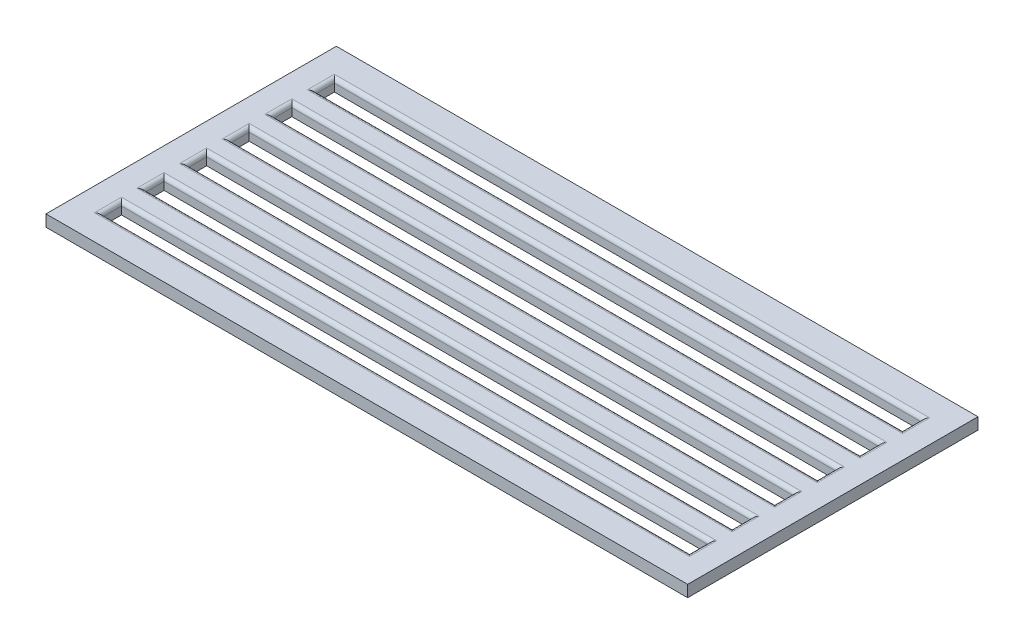
from build123d import *

# Parameters (mm, degrees)
SKETCH1_W           = 165.75
SKETCH1_H           = 75
BOSS_EXTRUDE1_DEPTH = 3
SKETCH2_W           = 151.75
SKETCH2_H           = 5
CUT_EXTRUDE1_DEPTH  = 183.692731916
FILLET4_R           = 1
FILLET5_R           = 1
FILLET6_R           = 1
FILLET7_R           = 1
FILLET8_R           = 1
FILLET9_R           = 1
FILLET10_R          = 1
FILLET11_R          = 1
FILLET12_R          = 1
FILLET13_R          = 1
FILLET14_R          = 1
FILLET15_R          = 1
FILLET16_R          = 1
FILLET17_R          = 1
FILLET18_R          = 1
FILLET19_R          = 1
FILLET20_R          = 1
FILLET21_R          = 1
FILLET22_R          = 1
FILLET23_R          = 1
FILLET24_R          = 1
FILLET25_R          = 1
FILLET26_R          = 1
FILLET27_R          = 1


with BuildPart() as part:
    # Sketch1 → Boss-Extrude1 (new body)
    with BuildSketch(Plane(origin=(0, 0, 0), x_dir=(1, 0, 0), z_dir=(0, 1, 0))):
        with Locations((-81.877808989, 41.393258427)):
            Rectangle(SKETCH1_W, SKETCH1_H)
    extrude(amount=BOSS_EXTRUDE1_DEPTH)

    # Sketch2 → Cut-Extrude1 (cut, through all)
    with BuildSketch(Plane(origin=(0, 3, 0), x_dir=(1, 0, 0), z_dir=(0, 1, 0))):
        with Locations((-81.877808989, 68.893258427)):
            Rectangle(SKETCH2_W, SKETCH2_H)
        with Locations((-81.877808989, 57.893258427)):
            Rectangle(SKETCH2_W, SKETCH2_H)
        with Locations((-81.877808989, 46.893258427)):
            Rectangle(SKETCH2_W, SKETCH2_H)
        with Locations((-81.877808989, 35.893258427)):
            Rectangle(SKETCH2_W, SKETCH2_H)
        with Locations((-81.877808989, 24.893258427)):
            Rectangle(SKETCH2_W, SKETCH2_H)
        with Locations((-81.877808989, 13.893258427)):
            Rectangle(SKETCH2_W, SKETCH2_H)
    extrude(amount=-CUT_EXTRUDE1_DEPTH, mode=Mode.SUBTRACT)

    # Fillet4
    fillet4_edges = [part.edges().sort_by_distance(p)[0] for p in [
        (-81.877808989, 3, -60.393258427),
    ]]
    fillet(fillet4_edges, radius=FILLET4_R)

    # Fillet5
    fillet5_edges = [part.edges().sort_by_distance(p)[0] for p in [
        (-81.877808989, 3, -66.393258427),
    ]]
    fillet(fillet5_edges, radius=FILLET5_R)

    # Fillet6
    fillet6_edges = [part.edges().sort_by_distance(p)[0] for p in [
        (-81.877808989, 3, -49.393258427),
    ]]
    fillet(fillet6_edges, radius=FILLET6_R)

    # Fillet7
    fillet7_edges = [part.edges().sort_by_distance(p)[0] for p in [
        (-81.877808989, 3, -55.393258427),
    ]]
    fillet(fillet7_edges, radius=FILLET7_R)

    # Fillet8
    fillet8_edges = [part.edges().sort_by_distance(p)[0] for p in [
        (-81.877808989, 3, -38.393258427),
    ]]
    fillet(fillet8_edges, radius=FILLET8_R)

    # Fillet9
    fillet9_edges = [part.edges().sort_by_distance(p)[0] for p in [
        (-81.877808989, 3, -44.393258427),
    ]]
    fillet(fillet9_edges, radius=FILLET9_R)

    # Fillet10
    fillet10_edges = [part.edges().sort_by_distance(p)[0] for p in [
        (-81.877808989, 3, -33.393258427),
    ]]
    fillet(fillet10_edges, radius=FILLET10_R)

    # Fillet11
    fillet11_edges = [part.edges().sort_by_distance(p)[0] for p in [
        (-81.877808989, 3, -27.393258427),
    ]]
    fillet(fillet11_edges, radius=FILLET11_R)

    # Fillet12
    fillet12_edges = [part.edges().sort_by_distance(p)[0] for p in [
        (-81.877808989, 3, -22.393258427),
    ]]
    fillet(fillet12_edges, radius=FILLET12_R)

    # Fillet13
    fillet13_edges = [part.edges().sort_by_distance(p)[0] for p in [
        (-81.877808989, 3, -16.393258427),
    ]]
    fillet(fillet13_edges, radius=FILLET13_R)

    # Fillet14
    fillet14_edges = [part.edges().sort_by_distance(p)[0] for p in [
        (-81.877808989, 3, -11.393258427),
    ]]
    fillet(fillet14_edges, radius=FILLET14_R)

    # Fillet15
    fillet15_edges = [part.edges().sort_by_distance(p)[0] for p in [
        (-81.877808989, 3, -71.393258427),
    ]]
    fillet(fillet15_edges, radius=FILLET15_R)

    # Fillet16
    fillet16_edges = [part.edges().sort_by_distance(p)[0] for p in [
        (-157.752808989, 3, -68.893258427),
    ]]
    fillet(fillet16_edges, radius=FILLET16_R)

    # Fillet17
    fillet17_edges = [part.edges().sort_by_distance(p)[0] for p in [
        (-157.752808989, 3, -57.893258427),
    ]]
    fillet(fillet17_edges, radius=FILLET17_R)

    # Fillet18
    fillet18_edges = [part.edges().sort_by_distance(p)[0] for p in [
        (-157.752808989, 3, -46.893258427),
    ]]
    fillet(fillet18_edges, radius=FILLET18_R)

    # Fillet19
    fillet19_edges = [part.edges().sort_by_distance(p)[0] for p in [
        (-157.752808989, 3, -35.893258427),
    ]]
    fillet(fillet19_edges, radius=FILLET19_R)

    # Fillet20
    fillet20_edges = [part.edges().sort_by_distance(p)[0] for p in [
        (-157.752808989, 3, -24.893258427),
    ]]
    fillet(fillet20_edges, radius=FILLET20_R)

    # Fillet21
    fillet21_edges = [part.edges().sort_by_distance(p)[0] for p in [
        (-157.752808989, 3, -13.893258427),
    ]]
    fillet(fillet21_edges, radius=FILLET21_R)

    # Fillet22
    fillet22_edges = [part.edges().sort_by_distance(p)[0] for p in [
        (-6.002808989, 3, -13.893258427),
    ]]
    fillet(fillet22_edges, radius=FILLET22_R)

    # Fillet23
    fillet23_edges = [part.edges().sort_by_distance(p)[0] for p in [
        (-6.002808989, 3, -24.893258427),
    ]]
    fillet(fillet23_edges, radius=FILLET23_R)

    # Fillet24
    fillet24_edges = [part.edges().sort_by_distance(p)[0] for p in [
        (-6.002808989, 3, -35.893258427),
    ]]
    fillet(fillet24_edges, radius=FILLET24_R)

    # Fillet25
    fillet25_edges = [part.edges().sort_by_distance(p)[0] for p in [
        (-6.002808989, 3, -46.893258427),
    ]]
    fillet(fillet25_edges, radius=FILLET25_R)

    # Fillet26
    fillet26_edges = [part.edges().sort_by_distance(p)[0] for p in [
        (-6.002808989, 3, -57.893258427),
    ]]
    fillet(fillet26_edges, radius=FILLET26_R)

    # Fillet27
    fillet27_edges = [part.edges().sort_by_distance(p)[0] for p in [
        (-6.002808989, 3, -68.893258427),
    ]]
    fillet(fillet27_edges, radius=FILLET27_R)


solid = part.part
